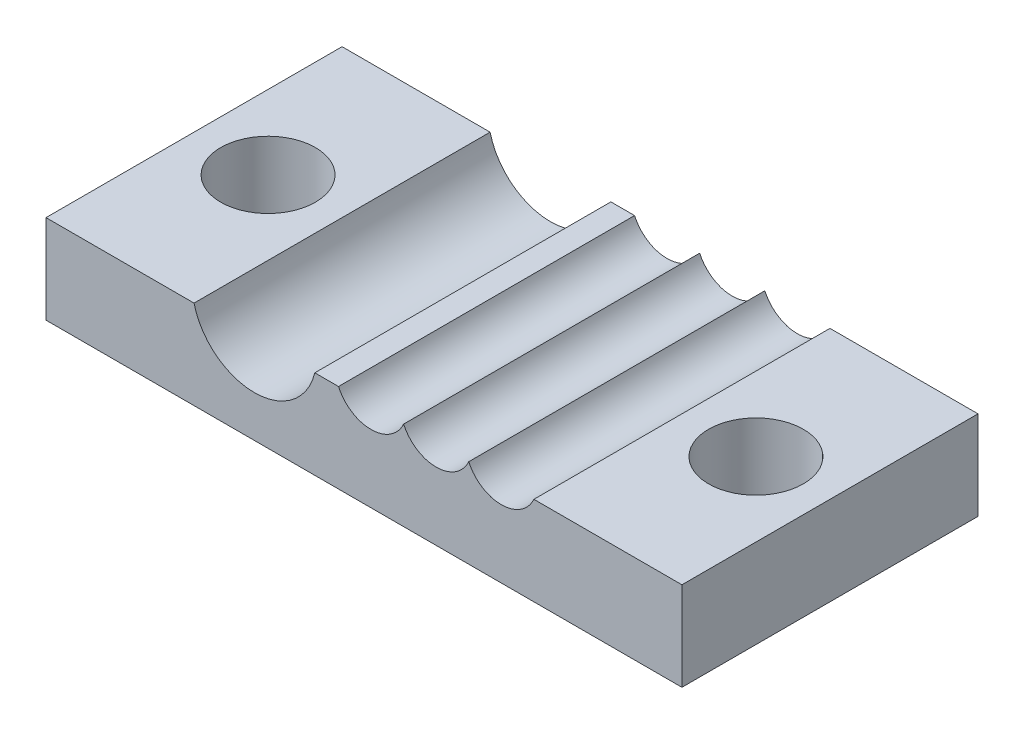
from build123d import *

# Parameters (mm, degrees)
BOSS_EXTRUDE1_DEPTH = 10
SKETCH2_R           = 1.6
CUT_EXTRUDE1_DEPTH  = 24.882141932


with BuildPart() as part:
    # Sketch1 → Boss-Extrude1 (new body)
    with BuildSketch(Plane.XY):
        with BuildLine():
            Line((0, 0), (21.479215611, 0))
            Line((21.479215611, 0), (21.479215611, 3))
            Line((21.479215611, 3), (16.479215611, 3))
            ThreePointArc((16.479215611, 3), (15.379215611, 2.291695403), (14.279215611, 3))
            ThreePointArc((14.279215611, 3), (13.179215611, 2.291695403), (12.079215611, 3))
            ThreePointArc((12.079215611, 3), (10.979215611, 2.291695403), (9.879215611, 3))
            Line((9.879215611, 3), (9.079215611, 3))
            ThreePointArc((9.079215611, 3), (7.039607805, 1.4), (5, 3))
            Line((5, 3), (0, 3))
            Line((0, 3), (0, 0))
        make_face()
    extrude(amount=BOSS_EXTRUDE1_DEPTH)

    # Sketch2 → Cut-Extrude1 (cut, through all)
    with BuildSketch(Plane.XZ):
        with Locations((2.5, 5)):
            Circle(SKETCH2_R)
        with Locations((18.979215611, 5)):
            Circle(SKETCH2_R)
    extrude(amount=-CUT_EXTRUDE1_DEPTH, mode=Mode.SUBTRACT)


solid = part.part
